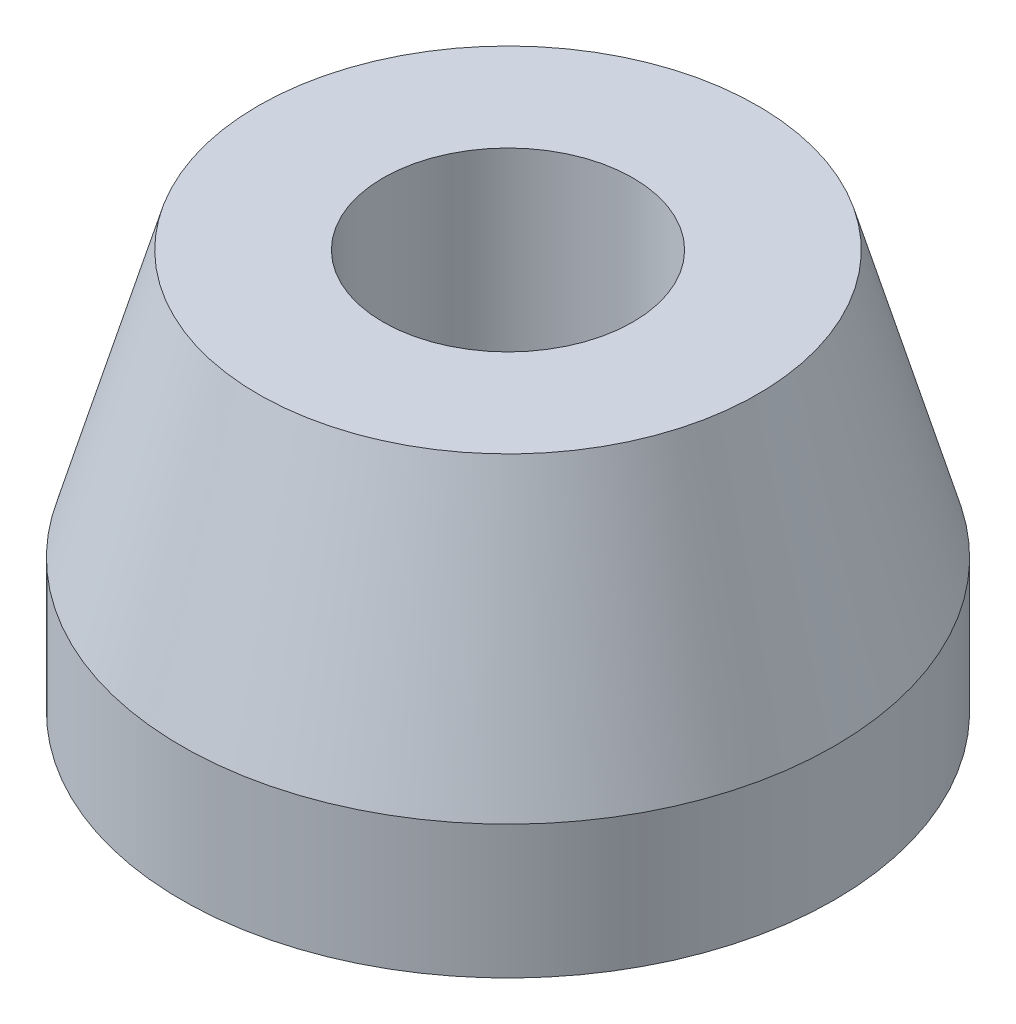
from build123d import *

# Parameters (mm, degrees)
CUT_EXTRUDE1_DEPTH      = 24.282255733
CUT_EXTRUDE1_DEPTH_BACK = 24.282255733
SKETCH2_R               = 4.7625


with BuildPart() as part:
    # Sketch1 → Revolve1 (revolve)
    with BuildSketch(Plane.XY):
        Polygon((0, 0), (-12.446, 0), (-12.446, 5.08), (-9.525, 15.24), (0, 15.24), align=None)
    revolve(axis=Axis((0, 15.24, 0), (0, -1, 0)))

    # Sketch2 → Cut-Extrude1 (cut, two sides: drawn at the far end of the back side and taken through both)
    with BuildSketch(Plane(origin=(0, 15.24, 0), x_dir=(1, 0, 0), z_dir=(0, 1, 0)).offset(-CUT_EXTRUDE1_DEPTH_BACK)):
        with Locations(Location((0, 0, 0), (0, 0, 180))):
            Circle(SKETCH2_R)
    extrude(amount=CUT_EXTRUDE1_DEPTH + CUT_EXTRUDE1_DEPTH_BACK, mode=Mode.SUBTRACT)


solid = part.part
